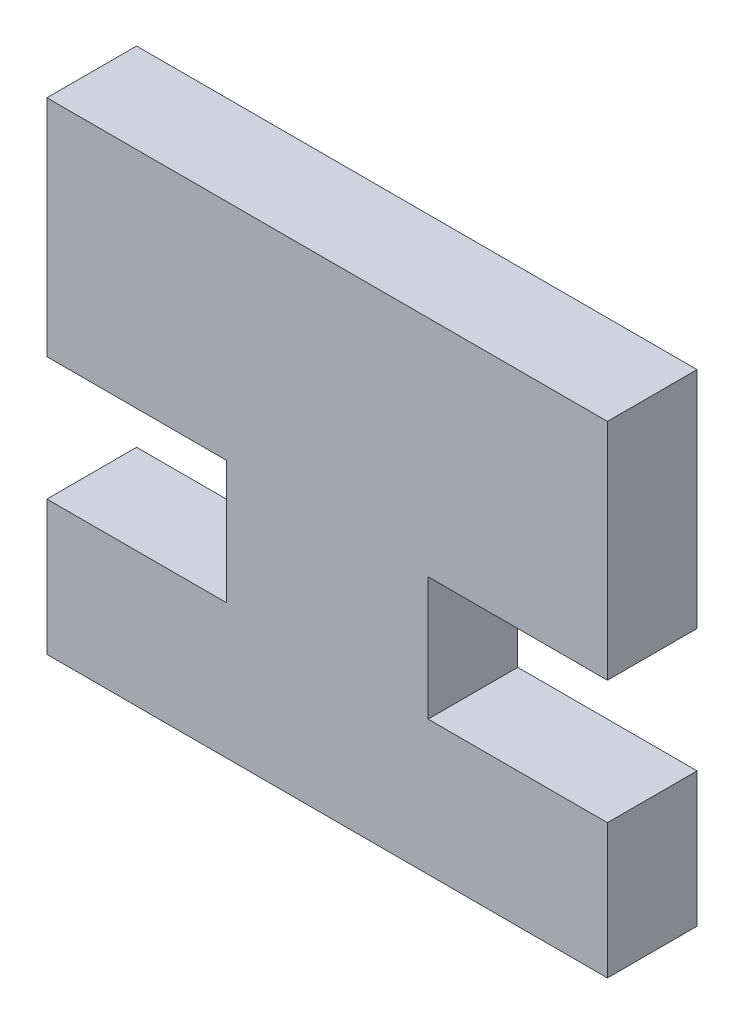
from build123d import *

# Parameters (mm, degrees)
BOSS_EXTRUDE1_DEPTH = 4


with BuildPart() as part:
    # Sketch1 → Boss-Extrude1 (new body)
    with BuildSketch(Plane.XY):
        Polygon((-83.171908981, 24.304447885), (-58.171908981, 24.304447885), (-58.171908981, 14.304447885), (-66.171908981, 14.304447885), (-66.171908981, 8.804447885), (-58.171908981, 8.804447885), (-58.171908981, 2.804447885), (-83.171908981, 2.804447885), (-83.171908981, 8.804447885), (-75.171908981, 8.804447885), (-75.171908981, 14.304447885), (-83.171908981, 14.304447885), align=None)
    extrude(amount=BOSS_EXTRUDE1_DEPTH)


solid = part.part
